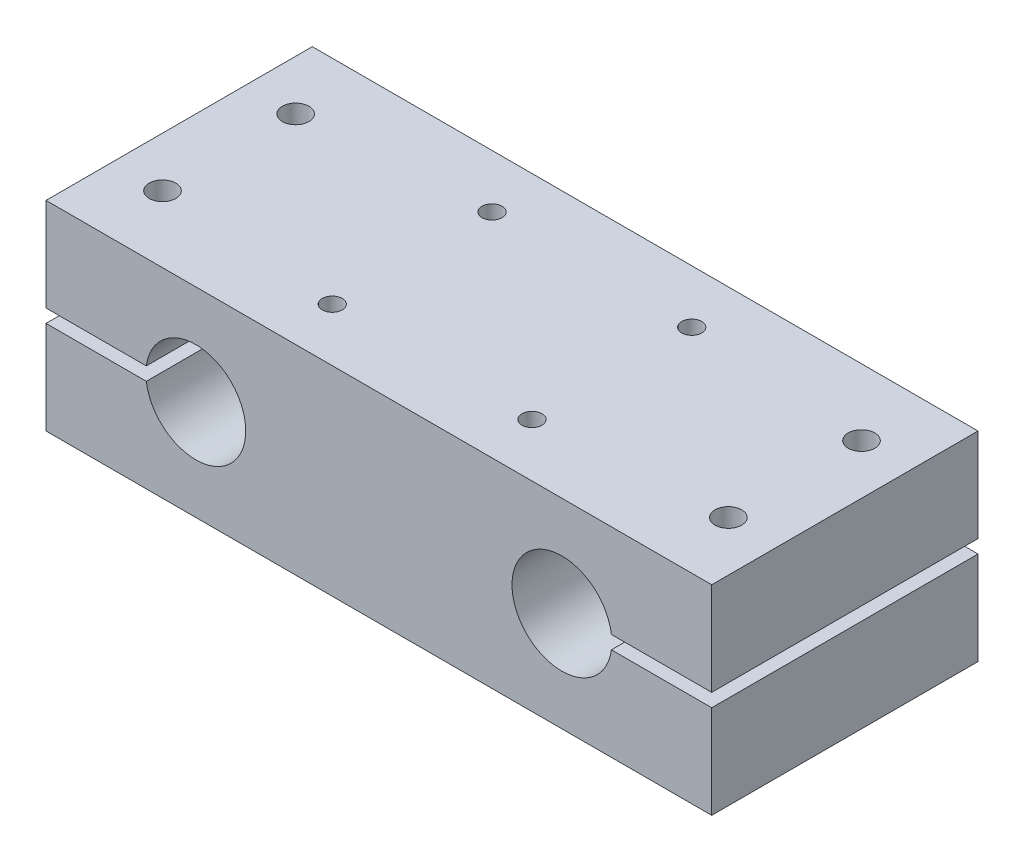
from build123d import *

# Parameters (mm, degrees)
EXTRUDE_1_DEPTH     = 40
SKETCH_2_R          = 2
SKETCH_2_R_2        = 1.5
CUT_EXTRUDE_1_DEPTH = 112.803398875


with BuildPart() as part:
    # Эскиз1 → Бобышка-Вытянуть1 (new body)
    with BuildSketch(Plane.XY):
        with BuildLine():
            Line((0, 0), (100, 0))
            Line((100, 0), (100, 14))
            Line((100, 14), (84.933034374, 14))
            ThreePointArc((84.933034374, 14), (70, 15), (84.933034374, 16))
            Line((84.933034374, 16), (100, 16))
            Line((100, 16), (100, 30))
            Line((100, 30), (0, 30))
            Line((0, 30), (0, 16))
            Line((0, 16), (15.066965626, 16))
            ThreePointArc((15.066965626, 16), (30, 15), (15.066965626, 14))
            Line((15.066965626, 14), (0, 14))
            Line((0, 14), (0, 0))
        make_face()
    extrude(amount=EXTRUDE_1_DEPTH)

    # Эскиз2 → Вырез-Вытянуть1 (cut, through all)
    with BuildSketch(Plane.XZ):
        with Locations(Location((7.5, 30, 0), (0, 0, 270))):
            Circle(SKETCH_2_R)
        with Locations(Location((7.5, 10, 0), (0, 0, 270))):
            Circle(SKETCH_2_R)
        with Locations(Location((92.5, 30, 0), (0, 0, 270))):
            Circle(SKETCH_2_R)
        with Locations(Location((92.5, 10, 0), (0, 0, 270))):
            Circle(SKETCH_2_R)
        with Locations(Location((35, 32, 0), (0, 0, 270))):
            Circle(SKETCH_2_R_2)
        with Locations(Location((65, 32, 0), (0, 0, 270))):
            Circle(SKETCH_2_R_2)
        with Locations(Location((35, 8, 0), (0, 0, 270))):
            Circle(SKETCH_2_R_2)
        with Locations(Location((65, 8, 0), (0, 0, 270))):
            Circle(SKETCH_2_R_2)
    extrude(amount=-CUT_EXTRUDE_1_DEPTH, mode=Mode.SUBTRACT)


solid = part.part
